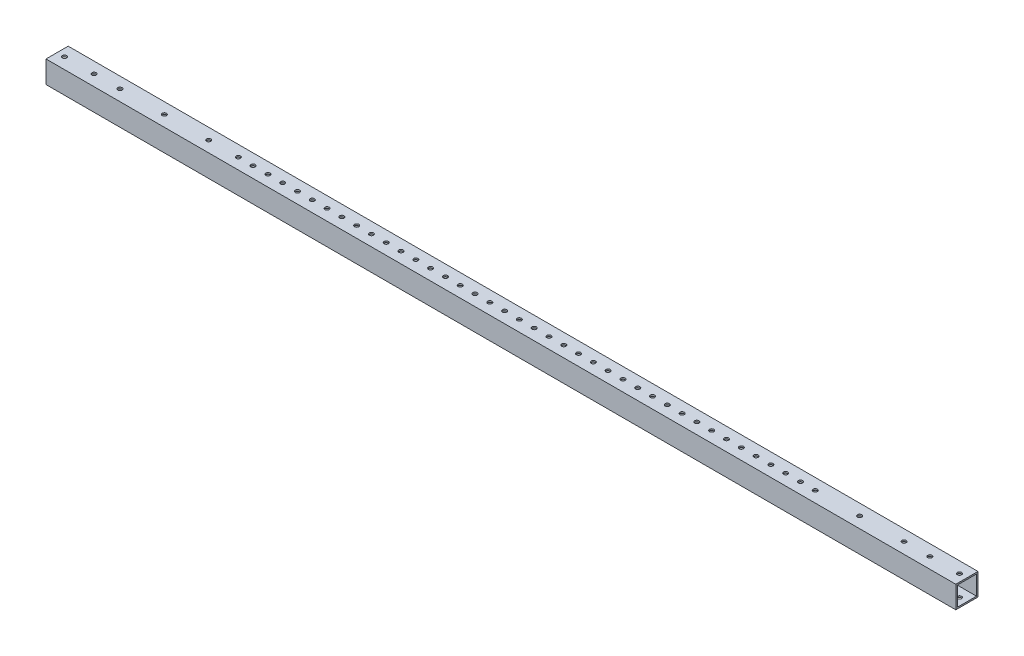
from build123d import *

# Parameters (mm, degrees)
SKETCH_11_W         = 15
SKETCH_11_H         = 15
SKETCH_11_W_2       = 13
SKETCH_11_H_2       = 13
F_15X15X1_1_DEPTH   = 615
SKETCH_12_R         = 1.45
CUT_EXTRUDE_1_DEPTH = 616.228616044
SKETCH_13_R         = 1.45
CUT_EXTRUDE_2_DEPTH = 616.228616044
SKETCH_14_R         = 1.45
CUT_EXTRUDE_3_DEPTH = 616.228616044


with BuildPart() as part:
    # 草图11 → 铝管 15X15X1(1) (new body)
    with BuildSketch(Plane.ZY):
        Rectangle(SKETCH_11_W, SKETCH_11_H)
        Rectangle(SKETCH_11_W_2, SKETCH_11_H_2, mode=Mode.SUBTRACT)
    extrude(amount=F_15X15X1_1_DEPTH)

    # 草图12 → 切除-拉伸1 (cut, through all)
    with BuildSketch(Plane(origin=(0, 7.5, 0), x_dir=(1, 0, 0), z_dir=(0, 1, 0))):
        with Locations(Location((-610, 0, 0), (0, 0, 270))):
            Circle(SKETCH_12_R)
        with Locations(Location((-590, 0, 0), (0, 0, 270))):
            Circle(SKETCH_12_R)
        with Locations(Location((-25, 0, 0), (0, 0, 90))):
            Circle(SKETCH_12_R)
        with Locations(Location((-5, 0, 0), (0, 0, 90))):
            Circle(SKETCH_12_R)
    extrude(amount=-CUT_EXTRUDE_1_DEPTH, mode=Mode.SUBTRACT)

    # 草图13 → 切除-拉伸2 (cut, through all)
    with BuildSketch(Plane.XZ.offset(7.5)):
        with Locations(Location((-102.5, 0, 0), (0, 0, 270))):
            Circle(SKETCH_13_R)
        with Locations(Location((-72.5, 0, 0), (0, 0, 270))):
            Circle(SKETCH_13_R)
        with Locations(Location((-42.5, 0, 0), (0, 0, 270))):
            Circle(SKETCH_13_R)
        with Locations(Location((-542.5, 0, 0), (0, 0, 270))):
            Circle(SKETCH_13_R)
        with Locations(Location((-512.5, 0, 0), (0, 0, 270))):
            Circle(SKETCH_13_R)
        with Locations(Location((-572.5, 0, 0), (0, 0, 270))):
            Circle(SKETCH_13_R)
    extrude(amount=-CUT_EXTRUDE_2_DEPTH, mode=Mode.SUBTRACT)

    # 草图14 → 切除-拉伸3 (cut, through all)
    with BuildSketch(Plane.XZ.offset(7.5)):
        with Locations(Location((-492.5, 0, 0), (0, 0, 270))):
            Circle(SKETCH_14_R)
        with Locations(Location((-482.5, 0, 0), (0, 0, 270))):
            Circle(SKETCH_14_R)
        with Locations(Location((-472.5, 0, 0), (0, 0, 270))):
            Circle(SKETCH_14_R)
        with Locations(Location((-462.5, 0, 0), (0, 0, 270))):
            Circle(SKETCH_14_R)
        with Locations(Location((-452.5, 0, 0), (0, 0, 270))):
            Circle(SKETCH_14_R)
        with Locations(Location((-442.5, 0, 0), (0, 0, 270))):
            Circle(SKETCH_14_R)
        with Locations(Location((-432.5, 0, 0), (0, 0, 270))):
            Circle(SKETCH_14_R)
        with Locations(Location((-422.5, 0, 0), (0, 0, 270))):
            Circle(SKETCH_14_R)
        with Locations(Location((-412.5, 0, 0), (0, 0, 270))):
            Circle(SKETCH_14_R)
        with Locations(Location((-402.5, 0, 0), (0, 0, 270))):
            Circle(SKETCH_14_R)
        with Locations(Location((-392.5, 0, 0), (0, 0, 270))):
            Circle(SKETCH_14_R)
        with Locations(Location((-382.5, 0, 0), (0, 0, 270))):
            Circle(SKETCH_14_R)
        with Locations(Location((-372.5, 0, 0), (0, 0, 270))):
            Circle(SKETCH_14_R)
        with Locations(Location((-362.5, 0, 0), (0, 0, 270))):
            Circle(SKETCH_14_R)
        with Locations(Location((-352.5, 0, 0), (0, 0, 270))):
            Circle(SKETCH_14_R)
        with Locations(Location((-342.5, 0, 0), (0, 0, 270))):
            Circle(SKETCH_14_R)
        with Locations(Location((-332.5, 0, 0), (0, 0, 270))):
            Circle(SKETCH_14_R)
        with Locations(Location((-322.5, 0, 0), (0, 0, 270))):
            Circle(SKETCH_14_R)
        with Locations(Location((-312.5, 0, 0), (0, 0, 270))):
            Circle(SKETCH_14_R)
        with Locations(Location((-302.5, 0, 0), (0, 0, 270))):
            Circle(SKETCH_14_R)
        with Locations(Location((-292.5, 0, 0), (0, 0, 270))):
            Circle(SKETCH_14_R)
        with Locations(Location((-282.5, 0, 0), (0, 0, 270))):
            Circle(SKETCH_14_R)
        with Locations(Location((-272.5, 0, 0), (0, 0, 270))):
            Circle(SKETCH_14_R)
        with Locations(Location((-262.5, 0, 0), (0, 0, 270))):
            Circle(SKETCH_14_R)
        with Locations(Location((-252.5, 0, 0), (0, 0, 270))):
            Circle(SKETCH_14_R)
        with Locations(Location((-242.5, 0, 0), (0, 0, 270))):
            Circle(SKETCH_14_R)
        with Locations(Location((-232.5, 0, 0), (0, 0, 270))):
            Circle(SKETCH_14_R)
        with Locations(Location((-222.5, 0, 0), (0, 0, 270))):
            Circle(SKETCH_14_R)
        with Locations(Location((-212.5, 0, 0), (0, 0, 270))):
            Circle(SKETCH_14_R)
        with Locations(Location((-202.5, 0, 0), (0, 0, 270))):
            Circle(SKETCH_14_R)
        with Locations(Location((-192.5, 0, 0), (0, 0, 270))):
            Circle(SKETCH_14_R)
        with Locations(Location((-182.5, 0, 0), (0, 0, 270))):
            Circle(SKETCH_14_R)
        with Locations(Location((-172.5, 0, 0), (0, 0, 270))):
            Circle(SKETCH_14_R)
        with Locations(Location((-162.5, 0, 0), (0, 0, 270))):
            Circle(SKETCH_14_R)
        with Locations(Location((-152.5, 0, 0), (0, 0, 270))):
            Circle(SKETCH_14_R)
        with Locations(Location((-142.5, 0, 0), (0, 0, 270))):
            Circle(SKETCH_14_R)
        with Locations(Location((-132.5, 0, 0), (0, 0, 270))):
            Circle(SKETCH_14_R)
        with Locations(Location((-122.5, 0, 0), (0, 0, 270))):
            Circle(SKETCH_14_R)
        with Locations(Location((-112.5, 0, 0), (0, 0, 270))):
            Circle(SKETCH_14_R)
    extrude(amount=-CUT_EXTRUDE_3_DEPTH, mode=Mode.SUBTRACT)


solid = part.part
